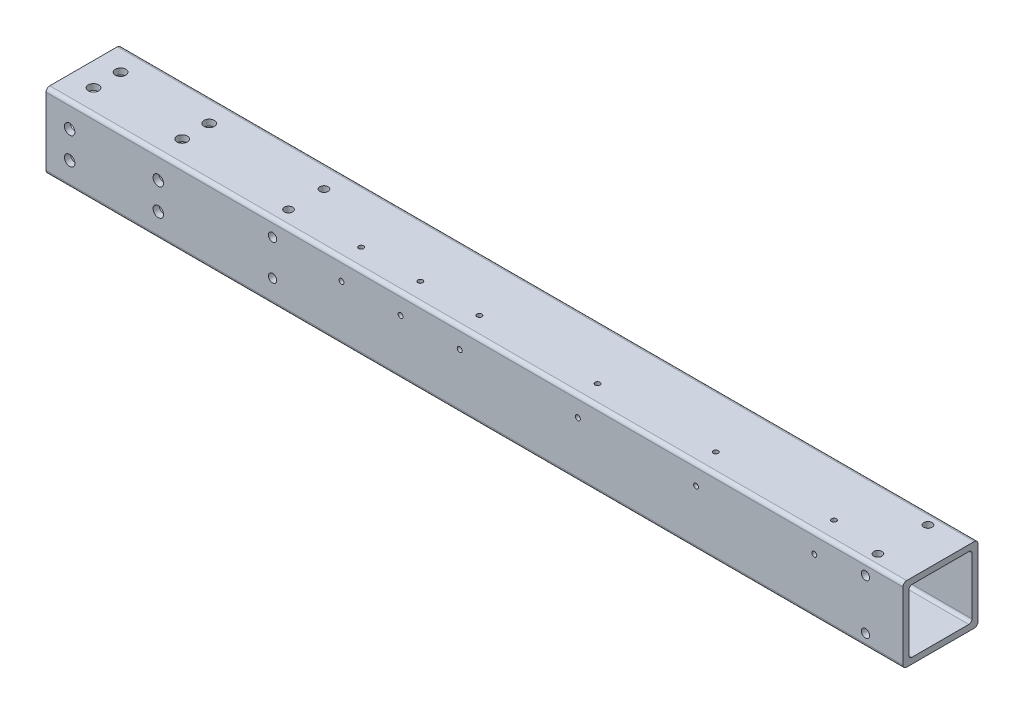
from build123d import *

# Parameters (mm, degrees)
BOSS_EXTRUDE1_DEPTH                  = 194
BOSS_EXTRUDE1_DEPTH_BACK             = 194
TAP_DRILL_FOR_M5X0_8_TAP1_D          = 4.2
TAP_DRILL_FOR_M5X0_8_TAP1_DEPTH      = 3.048
TAP_DRILL_FOR_M3X0_5_TAP1_D          = 2.5
TAP_DRILL_FOR_M3X0_5_TAP1_DEPTH      = 3.048
TAP_DRILL_FOR_M5X0_8_TAP2_AT_2_COUNT = 2
TAP_DRILL_FOR_M5X0_8_TAP2_AT_2_PITCH = 25.4
BOSS_EXTRUDE3_START                  = 40
BOSS_EXTRUDE3_DEPTH                  = 40
M5_CLEARANCE_HOLE1_D                 = 5.3
M5_CLEARANCE_HOLE1_DEPTH             = 3.048
BOSS_EXTRUDE4_START                  = 7
BOSS_EXTRUDE4_DEPTH                  = 7
F_8_0_8_DIAMETER_HOLE1_D             = 8
F_8_0_8_DIAMETER_HOLE1_DEPTH         = 3.048
F_8_0_8_DIAMETER_HOLE2_D             = 8
F_8_0_8_DIAMETER_HOLE2_DEPTH         = 3.048


with BuildPart() as part:
    # Sketch4 → Boss-Extrude1 (new, two sides: drawn at the far end of the back side and taken through both)
    with BuildSketch(Plane(origin=(0, 0, 0), x_dir=(0, 0, -1), z_dir=(1, 0, 0)).offset(-BOSS_EXTRUDE1_DEPTH_BACK)):
        with BuildLine():
            Line((19.05, -17.145), (19.05, 17.145))
            ThreePointArc((19.05, 17.145), (18.492038418, 18.492038418), (17.145, 19.05))
            Line((17.145, 19.05), (-17.145, 19.05))
            ThreePointArc((-17.145, 19.05), (-18.492038418, 18.492038418), (-19.05, 17.145))
            Line((-19.05, 17.145), (-19.05, -17.145))
            ThreePointArc((-19.05, -17.145), (-18.492038418, -18.492038418), (-17.145, -19.05))
            Line((-17.145, -19.05), (17.145, -19.05))
            ThreePointArc((17.145, -19.05), (18.492038418, -18.492038418), (19.05, -17.145))
        make_face()
        with BuildLine():
            Line((16.002, 14.4018), (16.002, -14.4018))
            ThreePointArc((16.002, -14.4018), (15.533312271, -15.533312271), (14.4018, -16.002))
            Line((14.4018, -16.002), (-14.4018, -16.002))
            ThreePointArc((-14.4018, -16.002), (-15.533312271, -15.533312271), (-16.002, -14.4018))
            Line((-16.002, -14.4018), (-16.002, 14.4018))
            ThreePointArc((-16.002, 14.4018), (-15.533312271, 15.533312271), (-14.4018, 16.002))
            Line((-14.4018, 16.002), (14.4018, 16.002))
            ThreePointArc((14.4018, 16.002), (15.533312271, 15.533312271), (16.002, 14.4018))
        make_face(mode=Mode.SUBTRACT)
    extrude(amount=BOSS_EXTRUDE1_DEPTH + BOSS_EXTRUDE1_DEPTH_BACK)

    # Tap Drill for M5x0.8 Tap1
    with Locations(Plane(origin=(0, 19.05, 0), x_dir=(1, 0, 0), z_dir=(0, 1, 0))):
        with Locations((-126, 7.05), (-126, -10.95)):
            tap_drill_for_m5x0_8_tap1 = Hole(TAP_DRILL_FOR_M5X0_8_TAP1_D / 2, depth=TAP_DRILL_FOR_M5X0_8_TAP1_DEPTH)

    # Tap Drill for M3x0.5 Tap1
    with Locations(Plane.XY.offset(19.05)):
        with Locations((149, 9.05), (89, 9.05), (29, 9.05), (-31, 9.05), (-91, 9.05), (-61, 9.05)):
            tap_drill_for_m3x0_5_tap1 = Hole(TAP_DRILL_FOR_M3X0_5_TAP1_D / 2, depth=TAP_DRILL_FOR_M3X0_5_TAP1_DEPTH)

    # Sketch22 → Tap Drill for M5x0.8 Tap2 (revolve, cut)
    with BuildSketch(Plane(origin=(174.95, 12.7, 19.05), x_dir=(0, -1, 0), z_dir=(1, 0, 0))):
        Polygon((0, 0), (0, 6.2618073), (2.1, 5), (2.1, 0), align=None)
    tap_drill_for_m5x0_8_tap2 = revolve(axis=Axis((174.95, 12.7, 25.4), (0, 0, -1)), mode=Mode.SUBTRACT)

    # Tap Drill for M5x0.8 Tap2 at 2: Tap Drill for M5x0.8 Tap2 ×2
    with Locations(*[(0, -i * TAP_DRILL_FOR_M5X0_8_TAP2_AT_2_PITCH, 0) for i in range(1, TAP_DRILL_FOR_M5X0_8_TAP2_AT_2_COUNT)]):
        add(tap_drill_for_m5x0_8_tap2, mode=Mode.SUBTRACT)

    # Mirror1: Tap Drill for M5x0.8 Tap1, Tap Drill for M3x0.5 Tap1, Tap Drill for M5x0.8 Tap2 across plane
    add(tap_drill_for_m5x0_8_tap1.mirror(Plane(origin=(0, 0, 0), x_dir=(0, 0.7071067811865478, 0.7071067811865472), z_dir=(0, -0.7071067811865475, 0.7071067811865477))), mode=Mode.SUBTRACT)
    add(tap_drill_for_m3x0_5_tap1.mirror(Plane(origin=(0, 0, 0), x_dir=(0, 0.7071067811865478, 0.7071067811865472), z_dir=(0, -0.7071067811865475, 0.7071067811865477))), mode=Mode.SUBTRACT)
    add(tap_drill_for_m5x0_8_tap2.mirror(Plane(origin=(0, 0, 0), x_dir=(0, 0.7071067811865478, 0.7071067811865472), z_dir=(0, -0.7071067811865475, 0.7071067811865477))), mode=Mode.SUBTRACT)

    # Mirror1 copy 1 sketch → Mirror1 copy 1 (revolve, cut)
    with BuildSketch(Plane(origin=(174.95, 19.05, -12.7), x_dir=(0, 0, -1), z_dir=(1, 0, 0))):
        Polygon((0, 0), (0, -6.2618073), (2.1, -5), (2.1, 0), align=None)
    revolve(axis=Axis((174.95, 25.4, -12.7), (0, 1, 0)), mode=Mode.SUBTRACT)

    # Sketch11 → Boss-Extrude3 (add)
    with BuildSketch(Plane.ZY.offset(194).offset(BOSS_EXTRUDE3_START)):
        with BuildLine():
            Line((-17.145, -19.05), (17.145, -19.05))
            ThreePointArc((17.145, -19.05), (18.492038418, -18.492038418), (19.05, -17.145))
            Line((19.05, -17.145), (19.05, 17.145))
            ThreePointArc((19.05, 17.145), (18.492038418, 18.492038418), (17.145, 19.05))
            Line((17.145, 19.05), (-17.145, 19.05))
            ThreePointArc((-17.145, 19.05), (-18.492038418, 18.492038418), (-19.05, 17.145))
            Line((-19.05, 17.145), (-19.05, -17.145))
            ThreePointArc((-19.05, -17.145), (-18.492038418, -18.492038418), (-17.145, -19.05))
        make_face()
        with BuildLine():
            Line((-16.002, 14.4018), (-16.002, -14.4018))
            ThreePointArc((-16.002, -14.4018), (-15.533312271, -15.533312271), (-14.4018, -16.002))
            Line((-14.4018, -16.002), (14.4018, -16.002))
            ThreePointArc((14.4018, -16.002), (15.533312271, -15.533312271), (16.002, -14.4018))
            Line((16.002, -14.4018), (16.002, 14.4018))
            ThreePointArc((16.002, 14.4018), (15.533312271, 15.533312271), (14.4018, 16.002))
            Line((14.4018, 16.002), (-14.4018, 16.002))
            ThreePointArc((-14.4018, 16.002), (-15.533312271, 15.533312271), (-16.002, 14.4018))
        make_face(mode=Mode.SUBTRACT)
    extrude(amount=-BOSS_EXTRUDE3_DEPTH)

    # M5 Clearance Hole1
    with Locations(Plane(origin=(0, 19.05, 0), x_dir=(1, 0, 0), z_dir=(0, 1, 0))):
        with Locations((-229, 6.8), (-229, -6.95), (-184, -6.95), (-184, 6.8)):
            m5_clearance_hole1 = Hole(M5_CLEARANCE_HOLE1_D / 2, depth=M5_CLEARANCE_HOLE1_DEPTH)

    # Mirror2: M5 Clearance Hole1 across plane
    add(m5_clearance_hole1.mirror(Plane(origin=(0, 0, 0), x_dir=(0, 0.7071067811865478, 0.7071067811865472), z_dir=(0, -0.7071067811865475, 0.7071067811865477))), mode=Mode.SUBTRACT)

    # Sketch16 → Boss-Extrude4 (add)
    with BuildSketch(Plane.ZY.offset(234).offset(BOSS_EXTRUDE4_START)):
        with BuildLine():
            Line((-17.145, -19.05), (17.145, -19.05))
            ThreePointArc((17.145, -19.05), (18.492038418, -18.492038418), (19.05, -17.145))
            Line((19.05, -17.145), (19.05, 17.145))
            ThreePointArc((19.05, 17.145), (18.492038418, 18.492038418), (17.145, 19.05))
            Line((17.145, 19.05), (-17.145, 19.05))
            ThreePointArc((-17.145, 19.05), (-18.492038418, 18.492038418), (-19.05, 17.145))
            Line((-19.05, 17.145), (-19.05, -17.145))
            ThreePointArc((-19.05, -17.145), (-18.492038418, -18.492038418), (-17.145, -19.05))
        make_face()
        with BuildLine():
            Line((-16.002, 14.4018), (-16.002, -14.4018))
            ThreePointArc((-16.002, -14.4018), (-15.533312271, -15.533312271), (-14.4018, -16.002))
            Line((-14.4018, -16.002), (14.4018, -16.002))
            ThreePointArc((14.4018, -16.002), (15.533312271, -15.533312271), (16.002, -14.4018))
            Line((16.002, -14.4018), (16.002, 14.4018))
            ThreePointArc((16.002, 14.4018), (15.533312271, 15.533312271), (14.4018, 16.002))
            Line((14.4018, 16.002), (-14.4018, 16.002))
            ThreePointArc((-14.4018, 16.002), (-15.533312271, 15.533312271), (-16.002, 14.4018))
        make_face(mode=Mode.SUBTRACT)
    extrude(amount=-BOSS_EXTRUDE4_DEPTH)

    # Ø8.0 (8) Diameter Hole1
    with Locations(Plane.XY.offset(-16.002)):
        with Locations((-229, -6.8), (-229, 6.95), (-184, 6.95), (-184, -6.8)):
            Hole(F_8_0_8_DIAMETER_HOLE1_D / 2, depth=F_8_0_8_DIAMETER_HOLE1_DEPTH)

    # Ø8.0 (8) Diameter Hole2
    with Locations(Plane(origin=(0, -16.002, 0), x_dir=(1, 0, 0), z_dir=(0, 1, 0))):
        with Locations((-229, 6.8), (-229, -6.95), (-184, -6.95), (-184, 6.8)):
            Hole(F_8_0_8_DIAMETER_HOLE2_D / 2, depth=F_8_0_8_DIAMETER_HOLE2_DEPTH)


solid = part.part
